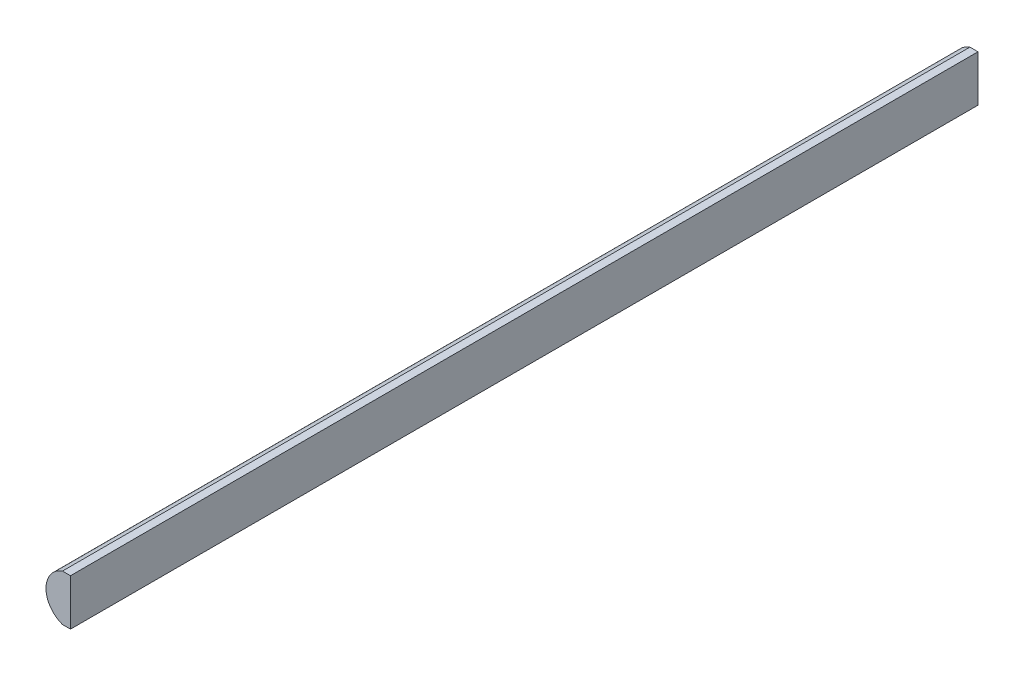
from build123d import *

# Parameters (mm, degrees)
BOSS_EXTRUDE1_DEPTH = 100


with BuildPart() as part:
    # Sketch1 → Boss-Extrude1 (new body)
    with BuildSketch(Plane.XY):
        with BuildLine():
            Line((0, 2.55), (-0.887411967, 2.55))
            ThreePointArc((-0.887411967, 2.55), (-2.7, 0), (-0.887411967, -2.55))
            Line((-0.887411967, -2.55), (0, -2.55))
            Line((0, -2.55), (0, 2.55))
        make_face()
    extrude(amount=BOSS_EXTRUDE1_DEPTH)


solid = part.part
